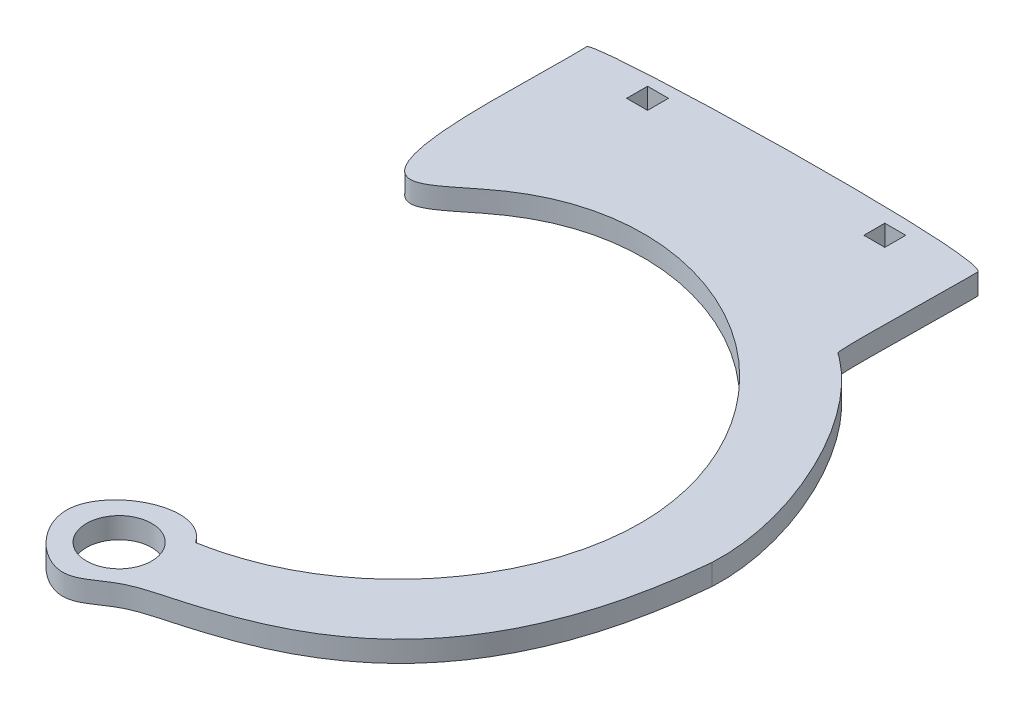
from build123d import *

# Parameters (mm, degrees)
BOSS_EXTRUDE1_DEPTH = 3
SKETCH2_R           = 4.675
CUT_EXTRUDE1_DEPTH  = 3
SKETCH3_W           = 3
SKETCH3_H           = 3
CUT_EXTRUDE2_DEPTH  = 158.536607671


with BuildPart() as part:
    # Sketch1 → Boss-Extrude1 (new body)
    with BuildSketch(Plane(origin=(0, 0, 0), x_dir=(1, 0, 0), z_dir=(0, 1, 0))):
        with BuildLine():
            add(Edge.make_bspline(
                [(5.521557484, -34.56171875), (23.441000999, -31.411738399), (44.462398529, -2.858835803), (20.37501589, 35.351246157), (-9.407254112, 38.543487929), (-30.226183483, 17.996603235), (-27.722542629, 45.347476833), (-28.043237247, 56.504189732), (28.011039588, 57.687968628), (27.966939535, 46.950288995), (27.653737943, 35.240695817), (37.551526977, 28.360483653), (45.587235651, 11.449809119), (45, 0)],
                knots=[0, 0, 0, 0, 0.082837565, 0.14873935, 0.208270658, 0.22410066, 0.277626869, 0.277626869, 0.285968064, 0.285968064, 0.310947599, 0.310947599, 1, 1, 1, 1], degree=3))
            add(Edge.make_bspline(
                [(45, 0), (41.835073021, -33.835409187), (19.767205368, -40.752570405), (4.477815504, -44.870859065), (-0.816124688, -50.460563609), (-14.262812638, -37.3251738), (1.754576266, -29.067892634), (5.521557484, -34.56171875)],
                knots=[0, 0, 0, 0, 0.439042234, 0.498130667, 0.590884333, 0.751564072, 1, 1, 1, 1], degree=3))
        make_face()
    extrude(amount=BOSS_EXTRUDE1_DEPTH)

    # Sketch2 → Cut-Extrude1 (cut)
    with BuildSketch(Plane(origin=(0, 3, 0), x_dir=(1, 0, 0), z_dir=(0, 1, 0))):
        with Locations(Location((0, -40, 0), (0, 0, 270))):
            Circle(SKETCH2_R)
    extrude(amount=-CUT_EXTRUDE1_DEPTH, mode=Mode.SUBTRACT)

    # Sketch3 → Cut-Extrude2 (cut, through all)
    with BuildSketch(Plane(origin=(-39.316746562, 9, -84.985711538), x_dir=(1, 0, 0), z_dir=(0, 1, 0))):
        with Locations((22.0910666, -32.023534202)):
            Rectangle(SKETCH3_W, SKETCH3_H)
        with Locations((56.0910666, -32.023534202)):
            Rectangle(SKETCH3_W, SKETCH3_H)
    extrude(amount=-CUT_EXTRUDE2_DEPTH, mode=Mode.SUBTRACT)


solid = part.part
